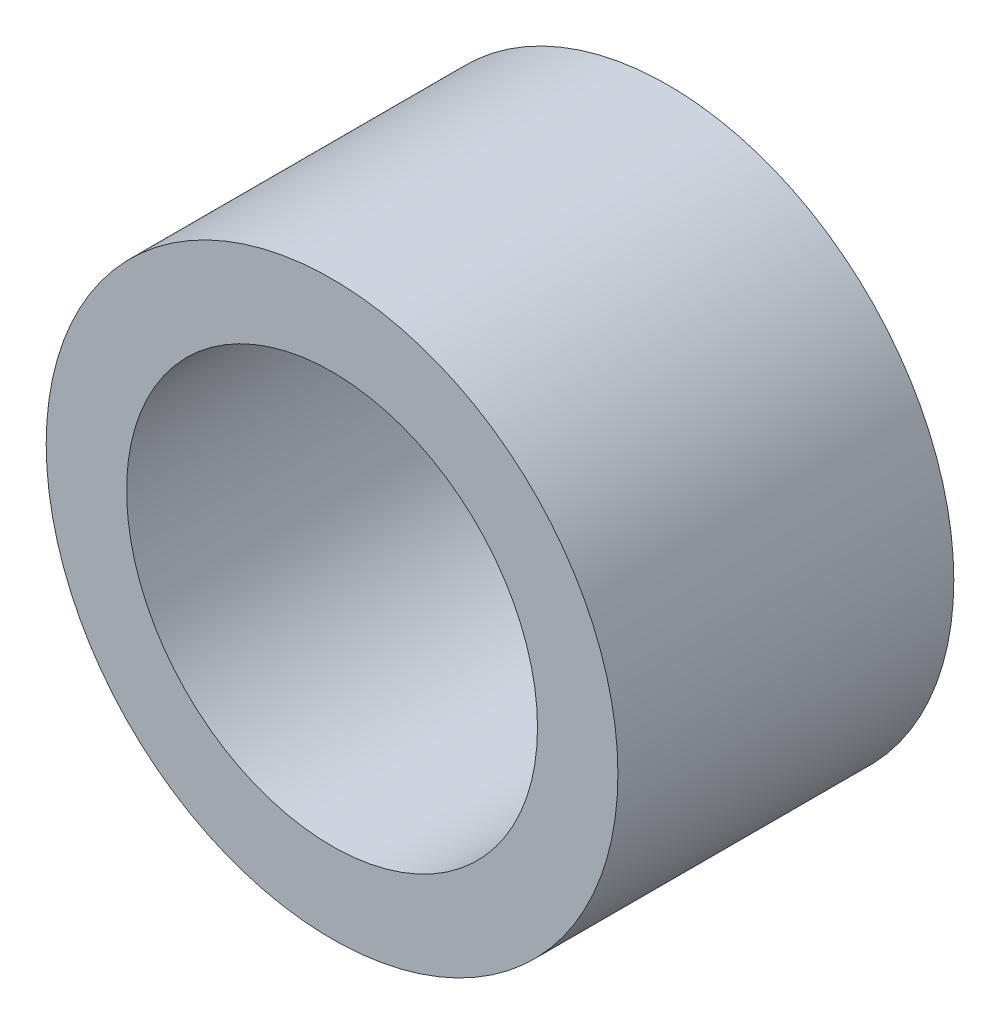
from build123d import *

# Parameters (mm, degrees)
BOSS_EXTRUDE1_DEPTH      = 64
BOSS_EXTRUDE1_DEPTH_BACK = 30
SKETCH2_R                = 80
SKETCH2_R_2              = 57.5


with BuildPart() as part:
    # Sketch2 → Boss-Extrude1 (new, two sides: drawn at the far end of the back side and taken through both)
    with BuildSketch(Plane.XY.offset(-BOSS_EXTRUDE1_DEPTH_BACK)):
        Circle(SKETCH2_R)
        Circle(SKETCH2_R_2, mode=Mode.SUBTRACT)
    extrude(amount=BOSS_EXTRUDE1_DEPTH + BOSS_EXTRUDE1_DEPTH_BACK)


solid = part.part
